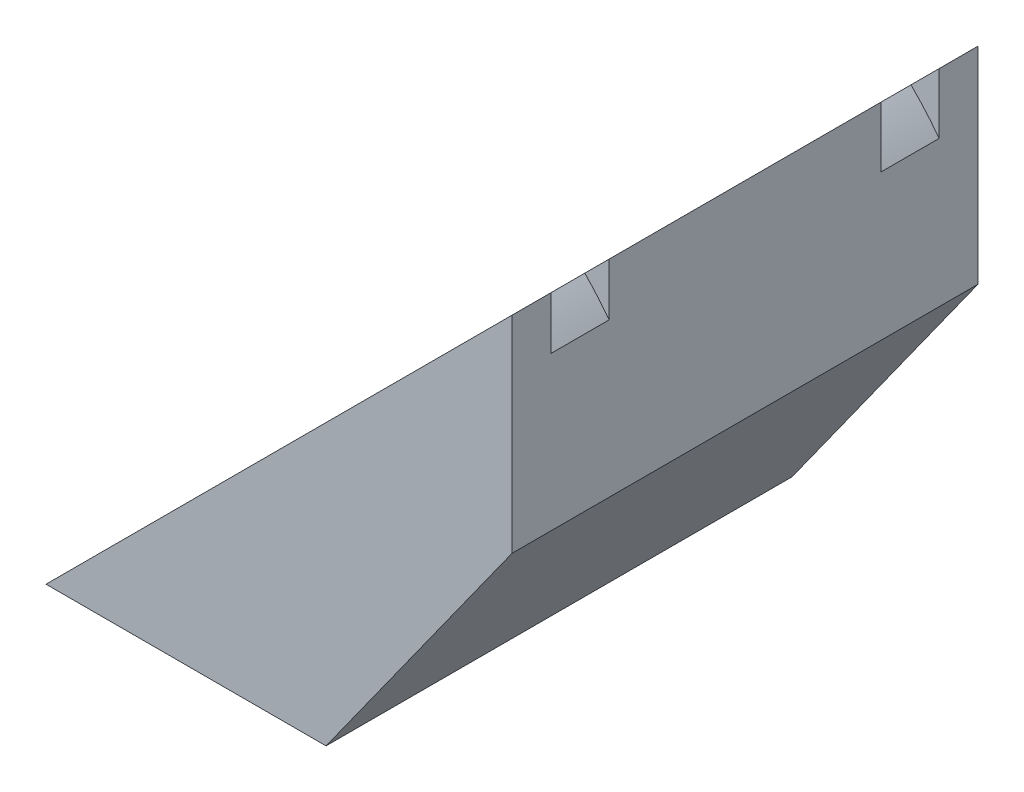
from build123d import *

# Parameters (mm, degrees)
SKETCH_1_W               = 24
SKETCH_1_H               = 24
EXTRUDE_1_DEPTH          = 24
SKETCH_2_W               = 71.732005
SKETCH_2_H               = 64.325513166
CUT_EXTRUDE_1_DEPTH      = 24
SKETCH_3_W               = 19.1
SKETCH_3_H               = 19.1
CUT_EXTRUDE_2_DEPTH      = 0.75
SKETCH_4_R               = 20.316156742
SKETCH_4_R_2             = 15
CUT_EXTRUDE_3_DEPTH      = 3
SKETCH_5_R               = 19.778815759
SKETCH_5_R_2             = 15
CUT_EXTRUDE_4_DEPTH      = 3
SKETCH_6_R               = 1.2
CUT_EXTRUDE_5_DEPTH      = 8
CUT_EXTRUDE_6_DEPTH      = 0.1
CUT_EXTRUDE_6_DEPTH_BACK = 0.1
SKETCH_7_W               = 8.073607186
SKETCH_7_H               = 16
CUT_EXTRUDE_7_DEPTH      = 15
CUT_EXTRUDE_7_DEPTH_BACK = 15


with BuildPart() as part:
    # Эскиз1 → Бобышка-Вытянуть1 (new body)
    with BuildSketch(Plane(origin=(0, 0, 0), x_dir=(1, 0, 0), z_dir=(0, 1, 0))):
        Rectangle(SKETCH_1_W, SKETCH_1_H)
    extrude(amount=EXTRUDE_1_DEPTH)

    # Эскиз2 → Вырез-Вытянуть1 (cut)
    with BuildSketch(Plane(origin=(-6, 6, 0), x_dir=(0.7071067811865477, 0.7071067811865475, 0), z_dir=(-0.7071067811865475, 0.7071067811865477, 0))):
        Rectangle(SKETCH_2_W, SKETCH_2_H)
    extrude(amount=CUT_EXTRUDE_1_DEPTH, mode=Mode.SUBTRACT)

    # Эскиз3 → Вырез-Вытянуть2 (cut)
    with BuildSketch(Plane(origin=(-6, 6, 0), x_dir=(0.7071067811865476, 0.7071067811865476, 0), z_dir=(-0.7071067811865476, 0.7071067811865476, 0))):
        with Locations((8.485281374, 0)):
            Rectangle(SKETCH_3_W, SKETCH_3_H)
    extrude(amount=-CUT_EXTRUDE_2_DEPTH, mode=Mode.SUBTRACT)

    # Эскиз4 → Вырез-Вытянуть3 (cut)
    with BuildSketch(Plane.XY.offset(10)):
        with Locations((0, 12.288929334)):
            Circle(SKETCH_4_R)
        with Locations((0, 12.288929334)):
            Circle(SKETCH_4_R_2, mode=Mode.SUBTRACT)
    extrude(amount=-CUT_EXTRUDE_3_DEPTH, mode=Mode.SUBTRACT)

    # Эскиз5 → Вырез-Вытянуть4 (cut)
    with BuildSketch(Plane.XY.offset(-10)):
        with Locations((0, 11.885010241)):
            Circle(SKETCH_5_R)
        with Locations((0, 11.885010241)):
            Circle(SKETCH_5_R_2, mode=Mode.SUBTRACT)
    extrude(amount=CUT_EXTRUDE_4_DEPTH, mode=Mode.SUBTRACT)

    # Эскиз6 → Вырез-Вытянуть5 (cut)
    with BuildSketch(Plane(origin=(0, 0, 0), x_dir=(1, 0, 0), z_dir=(0, 1, 0))):
        Circle(SKETCH_6_R)
    extrude(amount=CUT_EXTRUDE_5_DEPTH, mode=Mode.SUBTRACT)

    # Эскиз7 → Вырез-Вытянуть6 (cut, two sides: drawn at the far end of the back side and taken through both)
    with BuildSketch(Plane(origin=(0, 0, 0), x_dir=(0, 0, -1), z_dir=(1, 0, 0)).offset(-CUT_EXTRUDE_6_DEPTH_BACK)):
        Rectangle(SKETCH_7_W, SKETCH_7_H)
    extrude(amount=CUT_EXTRUDE_6_DEPTH + CUT_EXTRUDE_6_DEPTH_BACK, mode=Mode.SUBTRACT)

    # Эскиз8 → Вырез-Вытянуть7 (cut, two sides: drawn at the far end of the back side and taken through both)
    with BuildSketch(Plane.XY.offset(-CUT_EXTRUDE_7_DEPTH_BACK)):
        Polygon((0.926133031, -2.090276762), (18.080980338, 21.871040762), (23.544619253, -7.469690988), align=None)
    extrude(amount=CUT_EXTRUDE_7_DEPTH + CUT_EXTRUDE_7_DEPTH_BACK, mode=Mode.SUBTRACT)


solid = part.part
